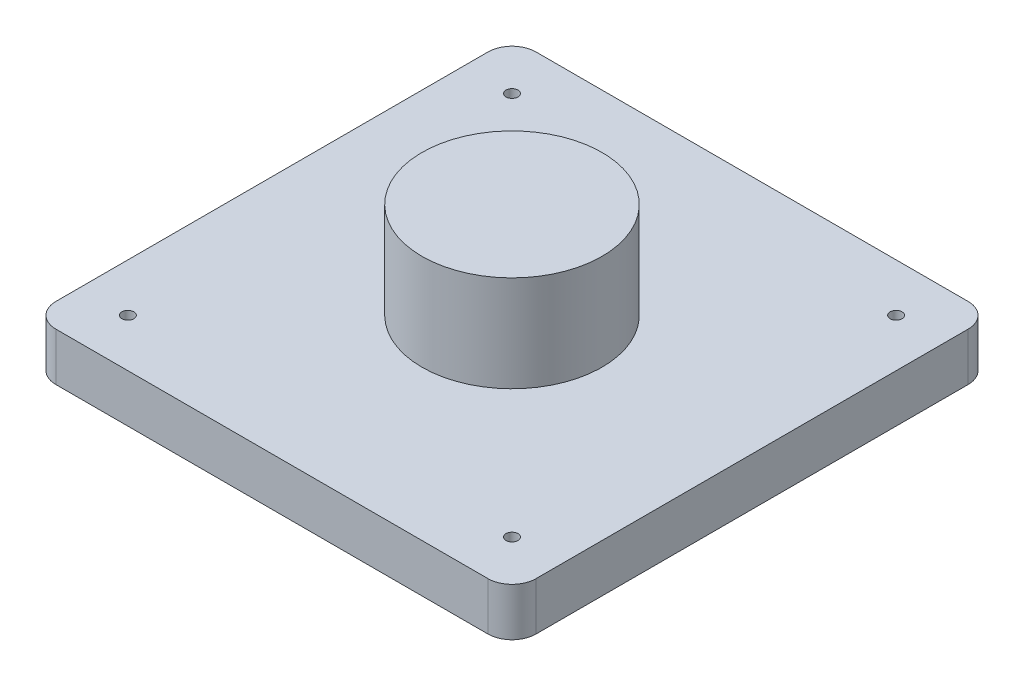
from build123d import *

# Parameters (mm, degrees)
BOSS_EXTRUDE1_DEPTH = 20
SKETCH2_R           = 37.5
BOSS_EXTRUDE2_DEPTH = 40
CUT_EXTRUDE1_REACH  = 148.969
SKETCH3_R           = 2.5


with BuildPart() as part:
    # Sketch1 → Boss-Extrude1 (new body)
    with BuildSketch(Plane(origin=(0, 0, 0), x_dir=(1, 0, 0), z_dir=(0, 1, 0))):
        with BuildLine():
            Line((-90, -100), (90, -100))
            ThreePointArc((90, -100), (97.071067812, -97.071067812), (100, -90))
            Line((100, -90), (100, 90))
            ThreePointArc((100, 90), (97.071067812, 97.071067812), (90, 100))
            Line((90, 100), (-90, 100))
            ThreePointArc((-90, 100), (-97.071067812, 97.071067812), (-100, 90))
            Line((-100, 90), (-100, -90))
            ThreePointArc((-100, -90), (-97.071067812, -97.071067812), (-90, -100))
        make_face()
    extrude(amount=BOSS_EXTRUDE1_DEPTH)

    # Sketch2 → Boss-Extrude2 (add)
    with BuildSketch(Plane(origin=(0, 20, 0), x_dir=(1, 0, 0), z_dir=(0, 1, 0))):
        with Locations(Location((0, 0, 0), (0, 0, 270))):
            Circle(SKETCH2_R)
    extrude(amount=BOSS_EXTRUDE2_DEPTH)

    # Sketch3 → Cut-Extrude1 (cut, up to next)
    with BuildSketch(Plane(origin=(0, 20, 0), x_dir=(1, 0, 0), z_dir=(0, 1, 0)), mode=Mode.PRIVATE) as cut_extrude1_sk1:
        with Locations(Location((-80, 80, 0), (0, 0, 270))):
            Circle(SKETCH3_R)
    cut_extrude1_tool1 = extrude(cut_extrude1_sk1.sketch, amount=-CUT_EXTRUDE1_REACH, mode=Mode.PRIVATE) & part.part
    # Sketch3 → Cut-Extrude1 (cut, up to next)
    with BuildSketch(Plane(origin=(0, 20, 0), x_dir=(1, 0, 0), z_dir=(0, 1, 0)), mode=Mode.PRIVATE) as cut_extrude1_sk2:
        with Locations(Location((80, 80, 0), (0, 0, 270))):
            Circle(SKETCH3_R)
    cut_extrude1_tool2 = extrude(cut_extrude1_sk2.sketch, amount=-CUT_EXTRUDE1_REACH, mode=Mode.PRIVATE) & part.part
    # Sketch3 → Cut-Extrude1 (cut, up to next)
    with BuildSketch(Plane(origin=(0, 20, 0), x_dir=(1, 0, 0), z_dir=(0, 1, 0)), mode=Mode.PRIVATE) as cut_extrude1_sk3:
        with Locations(Location((80, -80, 0), (0, 0, 270))):
            Circle(SKETCH3_R)
    cut_extrude1_tool3 = extrude(cut_extrude1_sk3.sketch, amount=-CUT_EXTRUDE1_REACH, mode=Mode.PRIVATE) & part.part
    # Sketch3 → Cut-Extrude1 (cut, up to next)
    with BuildSketch(Plane(origin=(0, 20, 0), x_dir=(1, 0, 0), z_dir=(0, 1, 0)), mode=Mode.PRIVATE) as cut_extrude1_sk4:
        with Locations(Location((-80, -80, 0), (0, 0, 270))):
            Circle(SKETCH3_R)
    cut_extrude1_tool4 = extrude(cut_extrude1_sk4.sketch, amount=-CUT_EXTRUDE1_REACH, mode=Mode.PRIVATE) & part.part
    add(cut_extrude1_tool1.solids().sort_by_distance((-80, 20, -80))[0], mode=Mode.SUBTRACT)
    add(cut_extrude1_tool2.solids().sort_by_distance((80, 20, -80))[0], mode=Mode.SUBTRACT)
    add(cut_extrude1_tool3.solids().sort_by_distance((80, 20, 80))[0], mode=Mode.SUBTRACT)
    add(cut_extrude1_tool4.solids().sort_by_distance((-80, 20, 80))[0], mode=Mode.SUBTRACT)


solid = part.part
